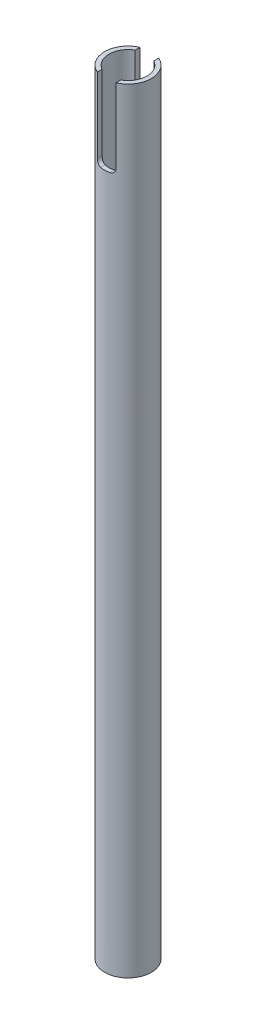
from build123d import *

# Parameters (mm, degrees)
BOSS_EXTRUDE1_START     = -123.394555
SKETCH1_R               = 7.9375
SKETCH1_R_2             = 6.4643
BOSS_EXTRUDE1_DEPTH     = 263.281039271
CUT_EXTRUDE2_DEPTH      = 141.336154622
CUT_EXTRUDE2_DEPTH_BACK = 141.336154622


with BuildPart() as part:
    # Sketch1 → Boss-Extrude1 (new body)
    with BuildSketch(Plane(origin=(0, 0, 0), x_dir=(1, 0, 0), z_dir=(0, 1, 0)).offset(BOSS_EXTRUDE1_START)):
        with Locations(Location((0, 0, 0), (0, 0, 270))):
            Circle(SKETCH1_R)
        with Locations(Location((0, 0, 0), (0, 0, 270))):
            Circle(SKETCH1_R_2, mode=Mode.SUBTRACT)
    extrude(amount=BOSS_EXTRUDE1_DEPTH)

    # Sketch2 → Cut-Extrude2 (cut, two sides: drawn at the far end of the back side and taken through both)
    with BuildSketch(Plane.XY.offset(-CUT_EXTRUDE2_DEPTH_BACK)):
        with BuildLine():
            Line((-3.175, 139.886484739), (3.175, 139.886484739))
            Line((3.175, 139.886484739), (3.175, 114.486484739))
            ThreePointArc((3.175, 114.486484739), (2.710032015, 113.363952724), (1.5875, 112.898984739))
            Line((1.5875, 112.898984739), (-1.5875, 112.898984739))
            ThreePointArc((-1.5875, 112.898984739), (-2.710032015, 113.363952724), (-3.175, 114.486484739))
            Line((-3.175, 114.486484739), (-3.175, 139.886484739))
        make_face()
    extrude(amount=CUT_EXTRUDE2_DEPTH + CUT_EXTRUDE2_DEPTH_BACK, mode=Mode.SUBTRACT)


solid = part.part
